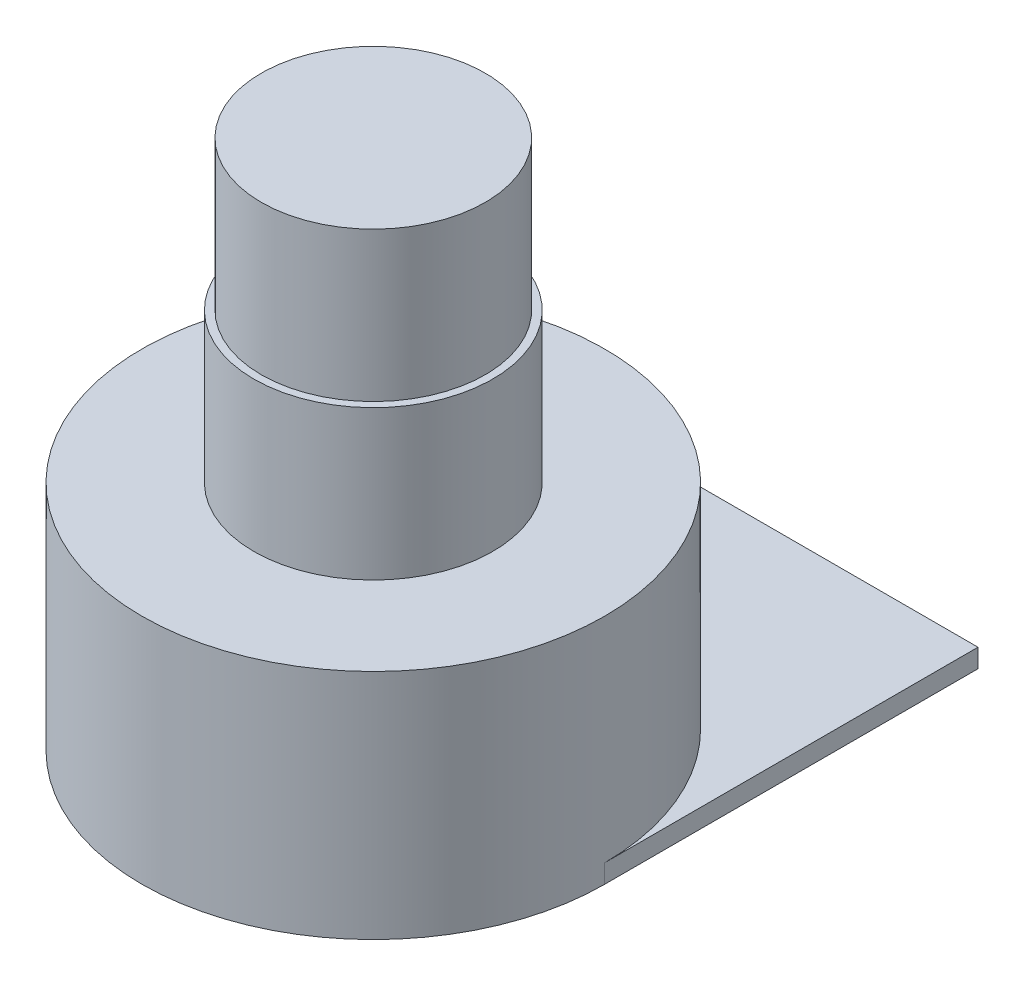
from build123d import *

# Parameters (mm, degrees)
SKETCH_1_R      = 6.2
EXTRUDE_1_DEPTH = 6.22
EXTRUDE_2_DEPTH = 0.5
SKETCH_3_R      = 3.2
EXTRUDE_3_DEPTH = 4
SKETCH_4_R      = 3
EXTRUDE_4_DEPTH = 4


with BuildPart() as part:
    # Эскиз1 → Вытянуть1 (new body)
    with BuildSketch(Plane(origin=(0, 0, 0), x_dir=(1, 0, 0), z_dir=(0, 1, 0))):
        with Locations(Location((0, 0, 0), (0, 0, 270))):
            Circle(SKETCH_1_R)
    extrude(amount=EXTRUDE_1_DEPTH)

    # Эскиз2 → Вытянуть2 (add)
    with BuildSketch(Plane.XZ):
        with BuildLine():
            Line((-6.2, 0), (-6.2, -10))
            Line((-6.2, -10), (6.2, -10))
            Line((6.2, -10), (6.2, 0))
            ThreePointArc((6.2, 0), (0, 6.2), (-6.2, 0))
        make_face()
    extrude(amount=-EXTRUDE_2_DEPTH)

    # Эскиз3 → Вытянуть3 (add)
    with BuildSketch(Plane(origin=(0, 6.22, 0), x_dir=(1, 0, 0), z_dir=(0, 1, 0))):
        with Locations(Location((0, 0, 0), (0, 0, 270))):
            Circle(SKETCH_3_R)
    extrude(amount=EXTRUDE_3_DEPTH)

    # Эскиз4 → Вытянуть4 (add)
    with BuildSketch(Plane(origin=(0, 10.22, 0), x_dir=(-1, 0, 0), z_dir=(0, 1, 0))):
        with Locations(Location((0, 0, 0), (0, 0, 90))):
            Circle(SKETCH_4_R)
    extrude(amount=EXTRUDE_4_DEPTH)


solid = part.part
